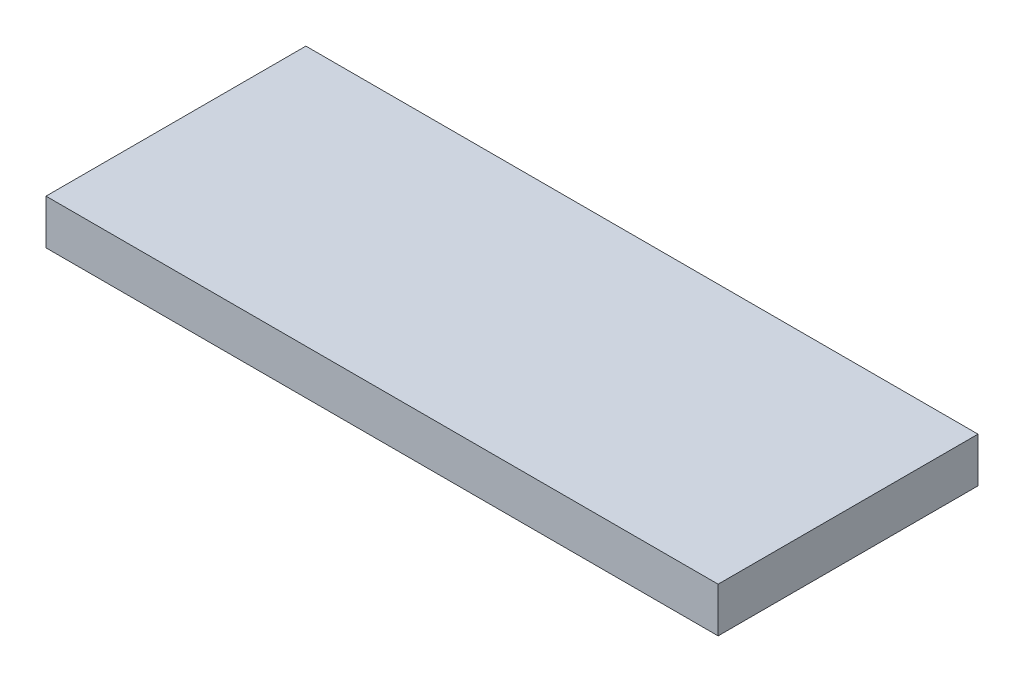
from build123d import *

# Parameters (mm, degrees)
SKETCH_1_W      = 75
SKETCH_1_H      = 29
EXTRUDE_1_DEPTH = 5


with BuildPart() as part:
    # 草图1 → 凸台-拉伸1 (new body)
    with BuildSketch(Plane(origin=(0, 0, 0), x_dir=(1, 0, 0), z_dir=(0, 1, 0))):
        with Locations((37.5, 14.5)):
            Rectangle(SKETCH_1_W, SKETCH_1_H)
    extrude(amount=EXTRUDE_1_DEPTH)


solid = part.part
